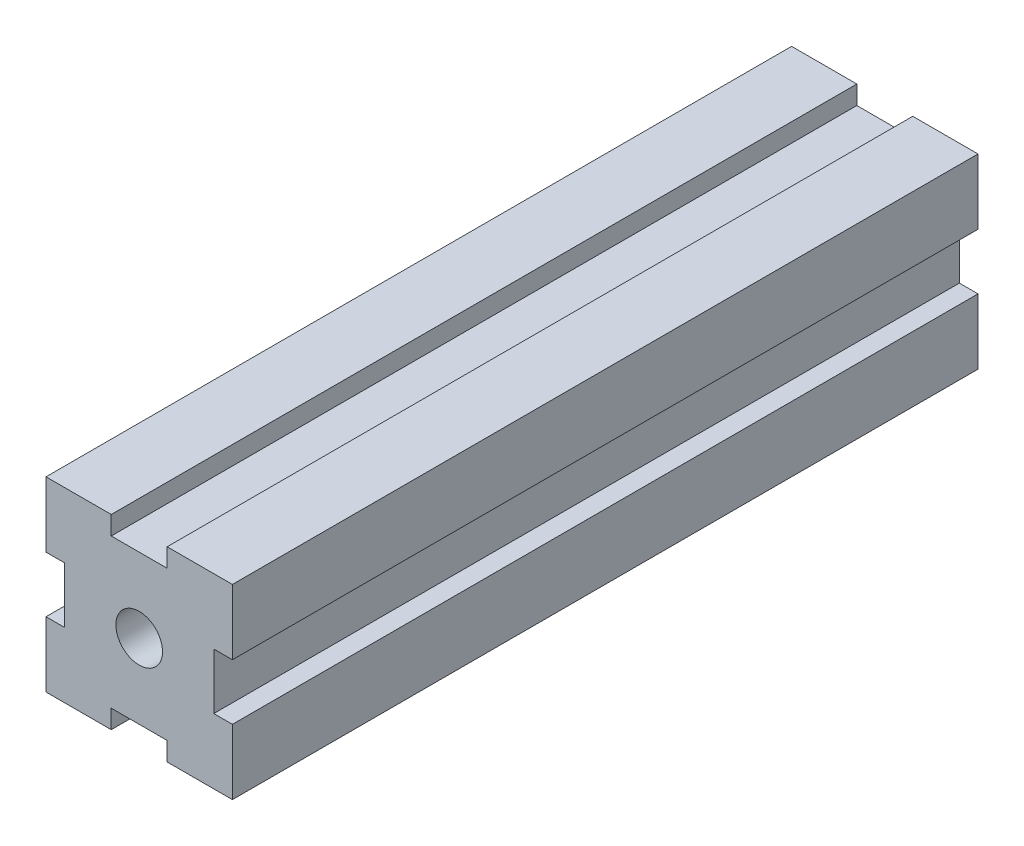
from build123d import *

# Parameters (mm, degrees)
SKETCH_1_R      = 2.5
EXTRUDE_1_DEPTH = 80


with BuildPart() as part:
    # 草图1 → 凸台-拉伸1 (new body)
    with BuildSketch(Plane.XY):
        Polygon((0, -13), (0, -20), (7, -20), (7, -18), (13, -18), (13, -20), (20, -20), (20, -13), (18, -13), (18, -7), (20, -7), (20, 0), (13, 0), (13, -2), (7, -2), (7, 0), (0, 0), (0, -7), (2, -7), (2, -13), align=None)
        with Locations((10, -10)):
            Circle(SKETCH_1_R, mode=Mode.SUBTRACT)
    extrude(amount=EXTRUDE_1_DEPTH)


solid = part.part
